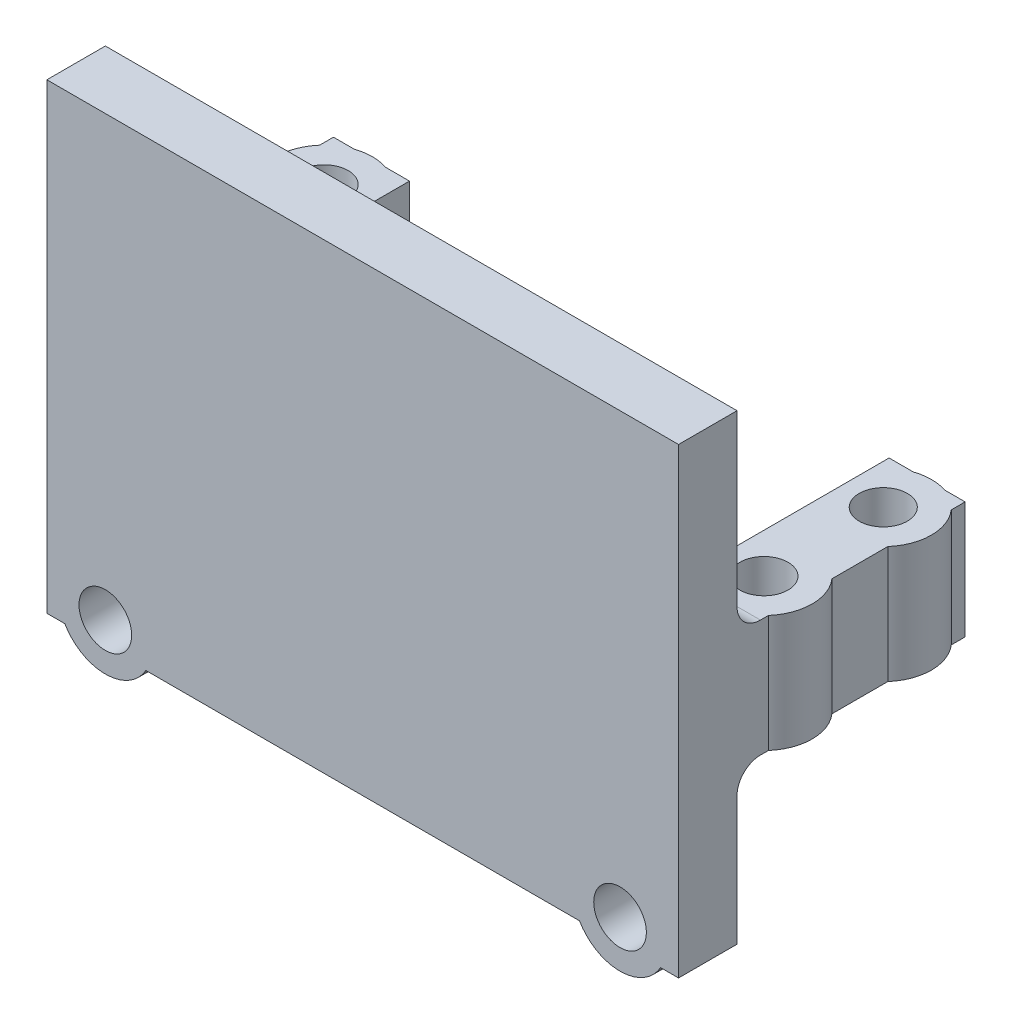
from build123d import *

# Parameters (mm, degrees)
SKETCH1_W           = 54
SKETCH1_H           = 26.5
BOSS_EXTRUDE1_DEPTH = 5
SKETCH2_W           = 6.5
SKETCH2_H           = 10
BOSS_EXTRUDE2_DEPTH = 19.5
SKETCH3_R           = 2.06
CUT_EXTRUDE1_DEPTH  = 19
SKETCH4_R           = 2.06
BOSS_EXTRUDE3_DEPTH = 10
FILLET1_R           = 1
FILLET2_R           = 2
SKETCH5_W           = 54
SKETCH5_H           = 5
BOSS_EXTRUDE4_DEPTH = 13
SKETCH6_R           = 2.25
CUT_EXTRUDE2_DEPTH  = 15
FILLET3_R           = 2
SKETCH7_R           = 4
SKETCH7_R_2         = 2.25
BOSS_EXTRUDE5_DEPTH = 5


with BuildPart() as part:
    # Sketch1 → Boss-Extrude1 (new body)
    with BuildSketch(Plane.XY):
        Rectangle(SKETCH1_W, SKETCH1_H)
    extrude(amount=BOSS_EXTRUDE1_DEPTH)

    # Sketch2 → Boss-Extrude2 (add)
    with BuildSketch(Plane(origin=(0, 0, 0), x_dir=(-1, 0, 0), z_dir=(0, 0, -1))):
        with Locations((-23.75, -8.25)):
            Rectangle(SKETCH2_W, SKETCH2_H)
        with Locations((23.75, -8.25)):
            Rectangle(SKETCH2_W, SKETCH2_H)
    extrude(amount=BOSS_EXTRUDE2_DEPTH)

    # Sketch3 → Cut-Extrude1 (cut)
    with BuildSketch(Plane.XZ.offset(13.25)):
        with Locations(Location((23.9, -15.6, 0), (0, 0, 270))):
            Circle(SKETCH3_R)
        with Locations(Location((-23.9, -5.4, 0), (0, 0, 270))):
            Circle(SKETCH3_R)
        with Locations(Location((23.9, -5.4, 0), (0, 0, 270))):
            Circle(SKETCH3_R)
        with Locations(Location((-23.9, -15.6, 0), (0, 0, 270))):
            Circle(SKETCH3_R)
    extrude(amount=-CUT_EXTRUDE1_DEPTH, mode=Mode.SUBTRACT)

    # Sketch4 → Boss-Extrude3 (add)
    # profile 1 of 4: a face of its own
    with BuildSketch(Plane.XZ.offset(13.25)):
        with BuildLine():
            Line((20.5, -17.926886332), (20.5, -13.273113668))
            ThreePointArc((20.5, -13.273113668), (28.02, -15.6), (20.5, -17.926886332))
        make_face()
        with Locations(Location((23.9, -15.6, 0), (0, 0, 270))):
            Circle(SKETCH4_R, mode=Mode.SUBTRACT)
    # profile 2 of 4: a face of its own
    with BuildSketch(Plane.XZ.offset(13.25)):
        with BuildLine():
            Line((20.5, -7.726886332), (20.5, -3.073113668))
            ThreePointArc((20.5, -3.073113668), (28.02, -5.4), (20.5, -7.726886332))
        make_face()
        with Locations(Location((23.9, -5.4, 0), (0, 0, 270))):
            Circle(SKETCH4_R, mode=Mode.SUBTRACT)
    # profile 3 of 4: a face of its own
    with BuildSketch(Plane.XZ.offset(13.25)):
        with BuildLine():
            Line((-20.5, -7.726886332), (-20.5, -3.073113668))
            ThreePointArc((-20.5, -3.073113668), (-28.02, -5.4), (-20.5, -7.726886332))
        make_face()
        with Locations(Location((-23.9, -5.4, 0), (0, 0, 270))):
            Circle(SKETCH4_R, mode=Mode.SUBTRACT)
    # profile 4 of 4: a face of its own
    with BuildSketch(Plane.XZ.offset(13.25)):
        with BuildLine():
            Line((-20.5, -17.926886332), (-20.5, -13.273113668))
            ThreePointArc((-20.5, -13.273113668), (-28.02, -15.6), (-20.5, -17.926886332))
        make_face()
        with Locations(Location((-23.9, -15.6, 0), (0, 0, 270))):
            Circle(SKETCH4_R, mode=Mode.SUBTRACT)
    extrude(amount=-BOSS_EXTRUDE3_DEPTH)

    # Fillet1
    fillet1_edges = [part.edges().sort_by_distance(p)[0] for p in [
        (20.5, -8.25, 0),
        (-20.5, -8.25, 0),
    ]]
    fillet(fillet1_edges, radius=FILLET1_R)

    # Fillet2
    fillet2_edges = [part.edges().sort_by_distance(p)[0] for p in [
        (23.25, -3.25, 0),
        (-23.25, -3.25, 0),
    ]]
    fillet(fillet2_edges, radius=FILLET2_R)

    # Sketch5 → Boss-Extrude4 (add)
    with BuildSketch(Plane.XZ.offset(13.25)):
        with Locations((0, 2.5)):
            Rectangle(SKETCH5_W, SKETCH5_H)
    extrude(amount=BOSS_EXTRUDE4_DEPTH)

    # Sketch6 → Cut-Extrude2 (cut)
    with BuildSketch(Plane(origin=(0, 0, 0), x_dir=(-1, 0, 0), z_dir=(0, 0, -1))):
        with Locations((22, -24.25)):
            Circle(SKETCH6_R)
        with Locations((-22, -24.25)):
            Circle(SKETCH6_R)
    extrude(amount=-CUT_EXTRUDE2_DEPTH, mode=Mode.SUBTRACT)

    # Fillet3
    fillet3_edges = [part.edges().sort_by_distance(p)[0] for p in [
        (23.25, -13.25, 0),
        (-23.25, -13.25, 0),
    ]]
    fillet(fillet3_edges, radius=FILLET3_R)

    # Sketch7 → Boss-Extrude5 (add)
    # profile 1 of 2: a face of its own
    with BuildSketch(Plane(origin=(0, 0, 0), x_dir=(-1, 0, 0), z_dir=(0, 0, -1))):
        with Locations((22, -24.25)):
            Circle(SKETCH7_R)
        with Locations((22, -24.25)):
            Circle(SKETCH7_R_2, mode=Mode.SUBTRACT)
    # profile 2 of 2: a face of its own
    with BuildSketch(Plane(origin=(0, 0, 0), x_dir=(-1, 0, 0), z_dir=(0, 0, -1))):
        with Locations((-22, -24.25)):
            Circle(SKETCH7_R)
        with Locations((-22, -24.25)):
            Circle(SKETCH7_R_2, mode=Mode.SUBTRACT)
    extrude(amount=-BOSS_EXTRUDE5_DEPTH)


solid = part.part
